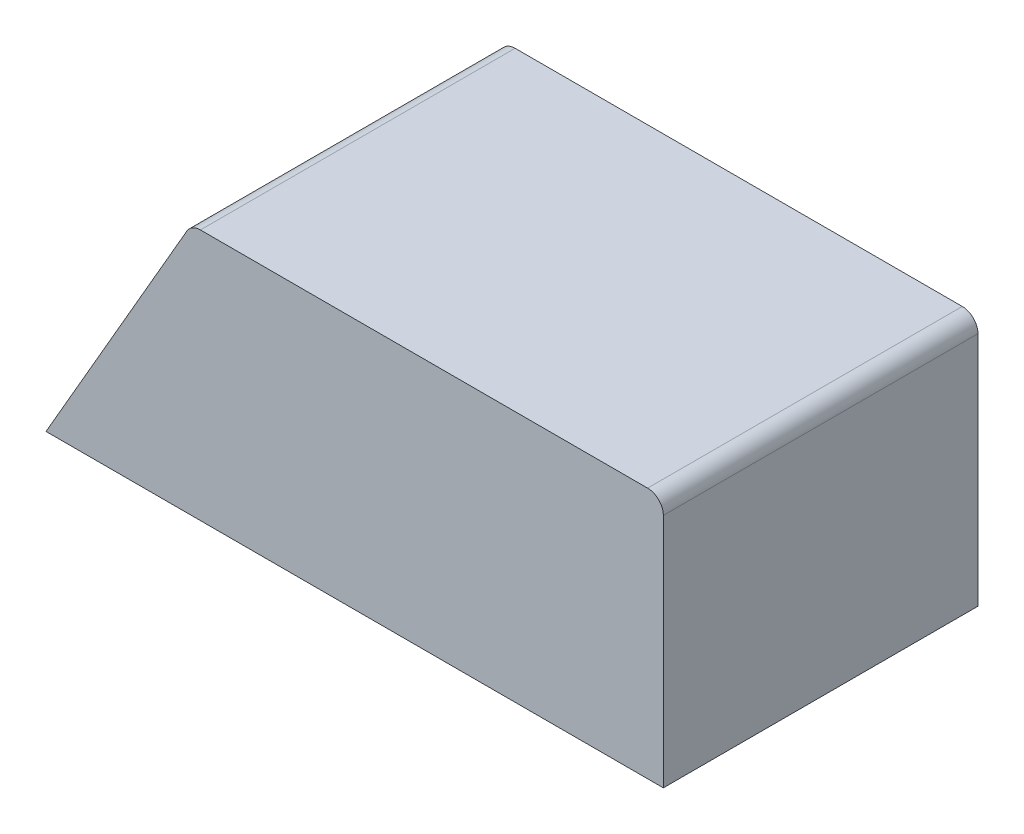
from build123d import *

# Parameters (mm, degrees)
BOSS_EXTRU_1_DEPTH = 5
CONG_1_R           = 0.5


with BuildPart() as part:
    # Esquisse1 → Boss.-Extru.1 (new, symmetric)
    with BuildSketch(Plane.XY):
        Polygon((-15, 8), (0, 8), (0, 0), (-19.618802154, 0), align=None)
    extrude(amount=BOSS_EXTRU_1_DEPTH, both=True)

    # Congé1
    cong_1_edges = [part.edges().sort_by_distance(p)[0] for p in [
        (-15, 8, 0),
        (0, 8, 0),
    ]]
    fillet(cong_1_edges, radius=CONG_1_R)


solid = part.part
